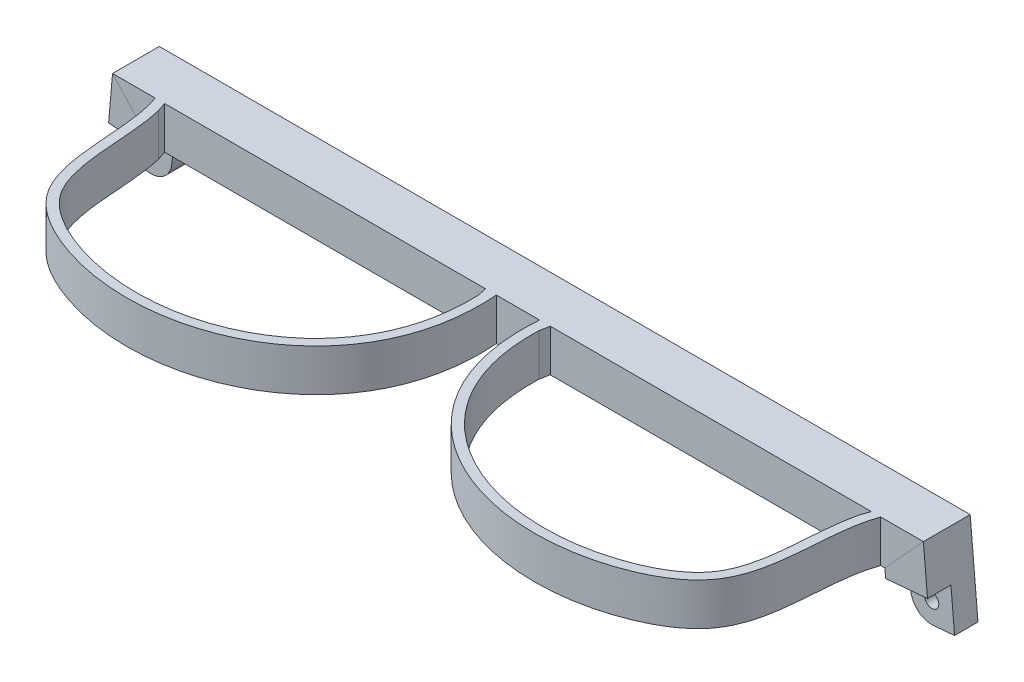
from build123d import *

# Parameters (mm, degrees)
FRAME_DEPTH            = 9
SKETCH_1033_W          = 10
SKETCH_1033_H          = 9
CONNECTION_2_DEPTH     = 103.044080854
SKETCH_23_W            = 10
SKETCH_23_H            = 9
SKETCH_24_R            = 1.5
AND_CONNECTION_DEPTH   = 103.044080854
SKETCH_1598_R          = 1.5
CUT_EXTRUDE_2777_DEPTH = 103.004936699
CONNECTION_4_DEPTH     = 5
CUT_EXTRUDE_4_DEPTH    = 5


with BuildPart() as part:
    # 草图1 → frame (new body)
    with BuildSketch(Plane(origin=(0, 0, 0), x_dir=(1, 0, 0), z_dir=(0, 1, 0))):
        Polygon((77.5, 21.66163142), (77.5, 11.66163142), (4.622356495, 11.66163142), (-4.622356495, 11.66163142), (-77.5, 11.66163142), (-77.5, 21.66163142), align=None)
        with BuildLine():
            add(Edge.make_bspline(
                [(77.5, 11.66163142), (74.407700798, 3.186863233), (78.13080327, -15.927288699), (40.25886312, -37.426028597), (2.116282918, -20.689046368), (4.622356495, 11.66163142)],
                knots=[0, 0, 0, 0, 0.2461215, 0.369792099, 1, 1, 1, 1], degree=3))
            Line((77.5, 11.66163142), (75.498489426, 11.66163142))
            Line((75.498489426, 11.66163142), (74.826320569, 9.66163142))
            add(Edge.make_bspline(
                [(74.826320569, 9.66163142), (74.537129512, 8.440205397), (74.118616889, 5.97852646), (73.621822389, 0.86906895), (73.254603503, -5.556962308), (72.241025744, -11.370637322), (70.601393479, -15.207799235), (68.270143007, -18.43048657), (63.731478169, -21.762919869), (56.85425746, -24.533410045), (49.722568077, -26.119696622), (40.058249914, -26.656581209), (30.63607695, -24.877975202), (22.314225365, -20.908251341), (16.828859323, -16.874650673), (12.291217041, -11.816635216), (9.449850549, -6.759991518), (7.834253455, -2.202532167), (6.977086921, 1.473147324), (6.581231794, 4.759863142), (6.469661343, 7.510165764), (6.485645336, 8.950311376), (6.511310136, 9.66163142)],
                knots=[0.022831488, 0.022831488, 0.022831488, 0.022831488, 0.052972273, 0.083113058, 0.143394628, 0.203676198, 0.233816983, 0.263957769, 0.324239339, 0.384520909, 0.444802479, 0.505084049, 0.625647189, 0.685928759, 0.746210329, 0.806491899, 0.866773469, 0.896914254, 0.92705504, 0.957195825, 0.972266217, 0.98733661, 0.98733661, 0.98733661, 0.98733661], degree=3))
            Line((6.511310136, 9.66163142), (6.907388487, 11.66163142))
            Line((6.907388487, 11.66163142), (4.622356495, 11.66163142))
        make_face()
        with BuildLine():
            Line((-75.498489426, 11.66163142), (-77.5, 11.66163142))
            add(Edge.make_bspline(
                [(-77.5, 11.66163142), (-74.407700798, 3.186863233), (-78.13080327, -15.927288699), (-40.25886312, -37.426028597), (-2.116282918, -20.689046368), (-4.622356495, 11.66163142)],
                knots=[0, 0, 0, 0, 0.2461215, 0.369792099, 1, 1, 1, 1], degree=3))
            Line((-4.622356495, 11.66163142), (-6.907388487, 11.66163142))
            Line((-6.907388487, 11.66163142), (-6.511310136, 9.66163142))
            add(Edge.make_bspline(
                [(-74.826320569, 9.66163142), (-74.537129512, 8.440205397), (-74.118616889, 5.97852646), (-73.621822389, 0.86906895), (-73.254603503, -5.556962308), (-72.241025744, -11.370637322), (-70.601393479, -15.207799235), (-68.270143007, -18.43048657), (-63.731478169, -21.762919869), (-56.85425746, -24.533410045), (-49.722568077, -26.119696622), (-40.058249914, -26.656581209), (-30.63607695, -24.877975202), (-22.314225365, -20.908251341), (-16.828859323, -16.874650673), (-12.291217041, -11.816635216), (-9.449850549, -6.759991518), (-7.834253455, -2.202532167), (-6.977086921, 1.473147324), (-6.581231794, 4.759863142), (-6.469661343, 7.510165764), (-6.485645336, 8.950311376), (-6.511310136, 9.66163142)],
                knots=[0.022831488, 0.022831488, 0.022831488, 0.022831488, 0.052972273, 0.083113058, 0.143394628, 0.203676198, 0.233816983, 0.263957769, 0.324239339, 0.384520909, 0.444802479, 0.505084049, 0.625647189, 0.685928759, 0.746210329, 0.806491899, 0.866773469, 0.896914254, 0.92705504, 0.957195825, 0.972266217, 0.98733661, 0.98733661, 0.98733661, 0.98733661], degree=3))
            Line((-74.826320569, 9.66163142), (-75.498489426, 11.66163142))
        make_face()
    extrude(amount=FRAME_DEPTH)

    # connection: sweep along a path in Sketch 1205
    with BuildLine(Plane(origin=(0, 0, -16.66163142), x_dir=(-1, 0, 0), z_dir=(0, 0, -1))) as connection_path:
        Line((-77.5, 4.5), (-82.5, 4.5))
        Line((-82.5, 4.5), (-83.807336141, -10.442920471))
    # Sketch 1033 → connection (sweep)
    with BuildSketch(Plane(origin=(77.5, 0, 0), x_dir=(0, 0, -1), z_dir=(1, 0, 0))):
        with Locations((16.66163142, 4.5)):
            Rectangle(SKETCH_1033_W, SKETCH_1033_H)
    sweep(path=connection_path.line, transition=Transition.RIGHT)

    # 草图20 → connection 2 (cut, through all)
    with BuildSketch(Plane(origin=(0, 0, -21.66163142), x_dir=(-1, 0, 0), z_dir=(0, 0, -1))):
        with BuildLine():
            Line((-79.32446, -10.835121314), (-83.807336141, -10.442920471))
            ThreePointArc((-83.807336141, -10.442920471), (-80.522591055, -9.407244324), (-78.932259157, -6.352245172))
            Line((-78.932259157, -6.352245172), (-79.32446, -10.835121314))
        make_face()
    extrude(amount=-CONNECTION_2_DEPTH, mode=Mode.SUBTRACT)

    # connection 3: sweep along a path in 草图22
    with BuildLine(Plane(origin=(0, 0, -16.66163142), x_dir=(-1, 0, 0), z_dir=(0, 0, -1))) as connection_3_path:
        Line((77.5, 4.5), (82.5, 4.5))
        Line((82.5, 4.5), (83.807336141, -10.442920471))
    # 草图23 → connection 3 (sweep)
    with BuildSketch(Plane.ZY.offset(77.5)):
        with Locations((-16.66163142, 4.5)):
            Rectangle(SKETCH_23_W, SKETCH_23_H)
    sweep(path=connection_3_path.line, transition=Transition.RIGHT)

    # 草图24 → 右侧孔and_connection圆角化 (cut, through all)
    with BuildSketch(Plane(origin=(0, 0, -21.66163142), x_dir=(-1, 0, 0), z_dir=(0, 0, -1))):
        with Locations((83.415135299, -5.96004433)):
            Circle(SKETCH_24_R)
        with BuildLine():
            Line((79.32446, -10.835121314), (83.807336141, -10.442920471))
            ThreePointArc((83.807336141, -10.442920471), (80.522591055, -9.407244324), (78.932259157, -6.352245172))
            Line((78.932259157, -6.352245172), (79.32446, -10.835121314))
        make_face()
    extrude(amount=-AND_CONNECTION_DEPTH, mode=Mode.SUBTRACT)

    # Sketch 1598 → Cut-Extrude 2777 (cut, through all)
    with BuildSketch(Plane(origin=(0, 0, -21.66163142), x_dir=(-1, 0, 0), z_dir=(0, 0, -1))):
        with Locations((-83.415135299, -5.96004433)):
            Circle(SKETCH_1598_R)
    extrude(amount=-CUT_EXTRUDE_2777_DEPTH, mode=Mode.SUBTRACT)

    # 草图27 → connection 4 (cut)
    with BuildSketch(Plane(origin=(0, 0, -16.66163142), x_dir=(-1, 0, 0), z_dir=(0, 0, -1))):
        with BuildLine():
            Line((-87.505810598, -1.084967346), (-78.540058315, -1.869369031))
            Line((-78.540058315, -1.869369031), (-78.932259157, -6.352245172))
            ThreePointArc((-78.932259157, -6.352245172), (-80.522591055, -9.407244324), (-83.807336141, -10.442920471))
            Line((-83.807336141, -10.442920471), (-88.290212283, -10.050719629))
            Line((-88.290212283, -10.050719629), (-87.505810598, -1.084967346))
        make_face()
    extrude(amount=-CONNECTION_4_DEPTH, mode=Mode.SUBTRACT)

    # 草图30 → 切除-拉伸4 (cut)
    with BuildSketch(Plane(origin=(0, 0, -16.66163142), x_dir=(-1, 0, 0), z_dir=(0, 0, -1))):
        with BuildLine():
            Line((88.290212283, -10.050719629), (83.807336141, -10.442920471))
            ThreePointArc((83.807336141, -10.442920471), (80.522591055, -9.407244324), (78.932259157, -6.352245172))
            Line((78.932259157, -6.352245172), (78.494187368, -1.345061709))
            Line((78.494187368, -1.345061709), (87.459939651, -0.560660024))
            Line((87.459939651, -0.560660024), (88.290212283, -10.050719629))
        make_face()
    extrude(amount=-CUT_EXTRUDE_4_DEPTH, mode=Mode.SUBTRACT)


solid = part.part
